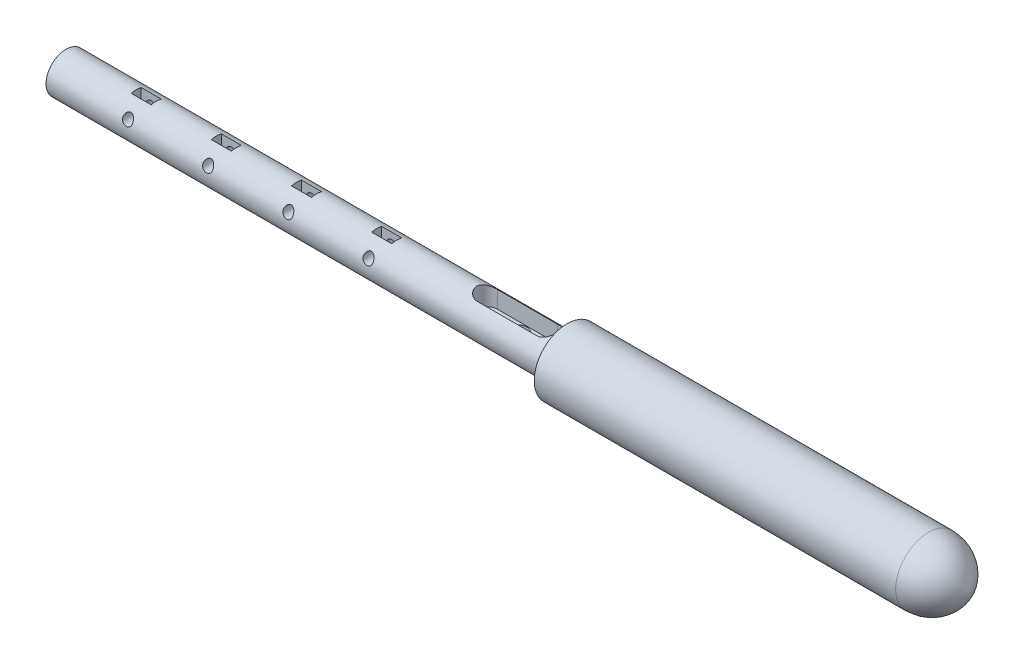
from build123d import *

# Parameters (mm, degrees)
SKETCH1_R                       = 3.175
BOSS_EXTRUDE1_DEPTH             = 127
CUT_EXTRUDE2_DEPTH              = 3.175
F_32_0_116_DIAMETER_HOLE1_D     = 2.9464
F_32_0_116_DIAMETER_HOLE1_DEPTH = 25.4
F_32_0_116_DIAMETER_HOLE1_TIP   = 0.885187864
SKETCH7_R                       = 0.79375
CUT_EXTRUDE3_DEPTH              = 5.08
SKETCH10_W                      = 3.175
SKETCH10_H                      = 1.5875
CUT_EXTRUDE4_DEPTH              = 5.715
LPATTERN1_COUNT                 = 4
LPATTERN1_PITCH                 = 12.7


with BuildPart() as part:
    # Sketch1 → Boss-Extrude1 (new body)
    with BuildSketch(Plane(origin=(0, 0, 0), x_dir=(0, 0, -1), z_dir=(1, 0, 0))):
        Circle(SKETCH1_R)
    extrude(amount=BOSS_EXTRUDE1_DEPTH)

    # Sketch2 → Revolve1 (revolve)
    with BuildSketch(Plane.XY):
        with BuildLine():
            Line((142.875, 0), (79.375, 0))
            Line((79.375, 0), (79.375, 5.207))
            Line((79.375, 5.207), (136.628717025, 5.207))
            ThreePointArc((136.628717025, 5.207), (140.694700916, 3.73452755), (142.875, 0))
        make_face()
    revolve(axis=Axis((127, 0, 0), (-1, 0, 0)))

    # Sketch4 → Cut-Extrude2 (cut)
    with BuildSketch(Plane(origin=(0, 0, 0), x_dir=(1, 0, 0), z_dir=(0, 1, 0))):
        with BuildLine():
            Line((76.2, 1.671783879), (66.675, 1.671783879))
            ThreePointArc((66.675, 1.671783879), (65.041030381, 0.03781426), (66.675, -1.596155359))
            Line((66.675, -1.596155359), (76.2, -1.596155359))
            ThreePointArc((76.2, -1.596155359), (77.833969619, 0.03781426), (76.2, 1.671783879))
        make_face()
    extrude(amount=CUT_EXTRUDE2_DEPTH, mode=Mode.SUBTRACT)

    # #32 (0.116) Diameter Hole1
    with Locations(Plane(origin=(0, 0, 0), x_dir=(-1, 0, 0), z_dir=(0, 1, 0))):
        with Locations((-71.4375, -0.084283879)):
            Hole(F_32_0_116_DIAMETER_HOLE1_D / 2, depth=F_32_0_116_DIAMETER_HOLE1_DEPTH)
            with Locations((0, 0, -(F_32_0_116_DIAMETER_HOLE1_DEPTH + F_32_0_116_DIAMETER_HOLE1_TIP / 2))):  # 118° drill point
                Cone(0, F_32_0_116_DIAMETER_HOLE1_D / 2, F_32_0_116_DIAMETER_HOLE1_TIP, mode=Mode.SUBTRACT)

    # Sketch7 → Cut-Extrude3 (cut, symmetric)
    with BuildSketch(Plane.XY):
        with Locations((12.7, 1.27)):
            Circle(SKETCH7_R)
    cut_extrude3 = extrude(amount=CUT_EXTRUDE3_DEPTH, both=True, mode=Mode.SUBTRACT)

    # Sketch10 → Cut-Extrude4 (cut)
    with BuildSketch(Plane(origin=(0, 0, 0), x_dir=(1, 0, 0), z_dir=(0, 1, 0))):
        with Locations((12.7, 0)):
            Rectangle(SKETCH10_W, SKETCH10_H)
    cut_extrude4 = extrude(amount=CUT_EXTRUDE4_DEPTH, mode=Mode.SUBTRACT)

    # LPattern1: Cut-Extrude3, Cut-Extrude4 ×4
    with Locations(*[(i * LPATTERN1_PITCH, 0, 0) for i in range(1, LPATTERN1_COUNT)]):
        add(cut_extrude3, mode=Mode.SUBTRACT)
        add(cut_extrude4, mode=Mode.SUBTRACT)


solid = part.part
